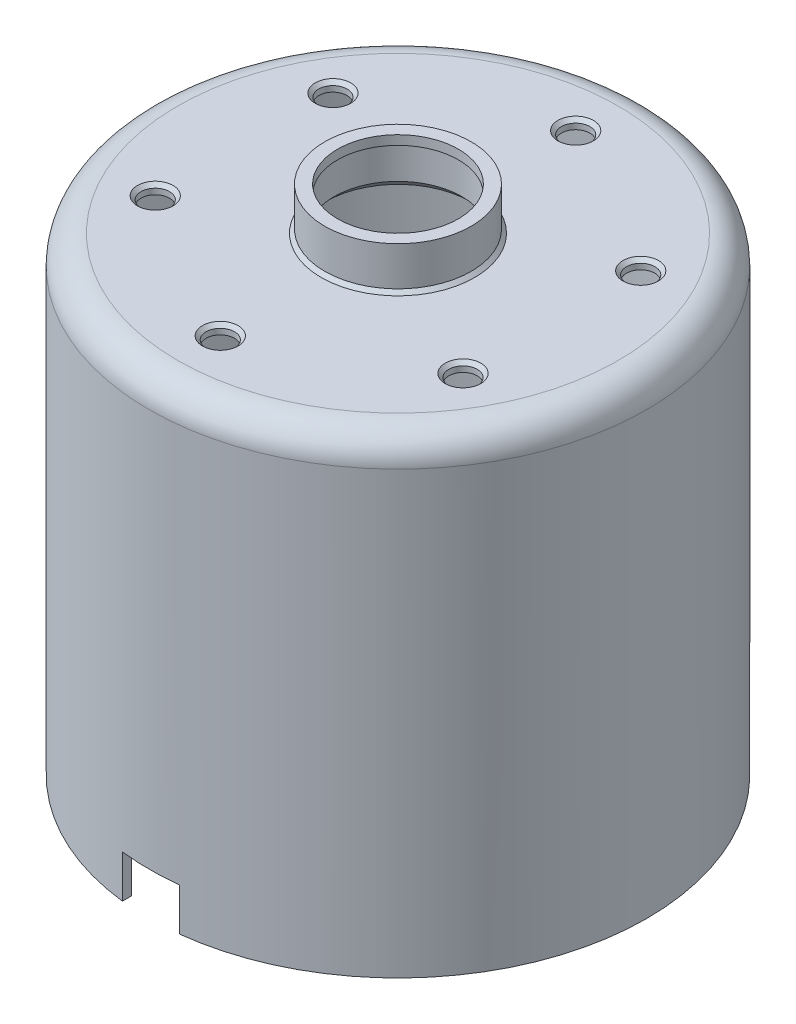
from build123d import *

# Parameters (mm, degrees)
SKETCH1_R                    = 17.5
BOSS_EXTRUDE1_DEPTH          = 33
FILLET1_R                    = 2
SKETCH3_R                    = 5.15
BOSS_EXTRUDE2_DEPTH          = 3
CHAMFER1_SIZE                = 0.25
SHELL1_T                     = -0.65
CUT_EXTRUDE1_REACH           = 45.686
SKETCH4_R                    = 4.25
CUT_EXTRUDE2_REACH           = 43.249
SKETCH5_R                    = 1
CHAMFER2_SIZE                = 0.25
CIRPATTERN1_COUNT            = 6
CHAMFER2_OF_CIRPATTERN1_SIZE = 0.25
CUT_EXTRUDE3_REACH           = 55.172
CUT_EXTRUDE3_END_RADIUS      = 16.85
SKETCH6_W                    = 4
SKETCH6_H                    = 6


with BuildPart() as part:
    # Sketch1 → Boss-Extrude1 (new body)
    with BuildSketch(Plane(origin=(0, 0, 0), x_dir=(1, 0, 0), z_dir=(0, 1, 0))):
        with Locations(Location((0, 0, 0), (0, 0, 270))):
            Circle(SKETCH1_R)
    extrude(amount=BOSS_EXTRUDE1_DEPTH)

    # Fillet1
    fillet1_edges = [part.edges().sort_by_distance(p)[0] for p in [
        (0, 33, -17.5),
    ]]
    fillet(fillet1_edges, radius=FILLET1_R)

    # Sketch3 → Boss-Extrude2 (add)
    with BuildSketch(Plane(origin=(0, 33, 0), x_dir=(1, 0, 0), z_dir=(0, 1, 0))):
        with Locations(Location((0, 0, 0), (0, 0, 270))):
            Circle(SKETCH3_R)
    extrude(amount=BOSS_EXTRUDE2_DEPTH)

    # Chamfer1
    chamfer1_edges = [part.edges().sort_by_distance(p)[0] for p in [
        (0, 33, -5.15),
    ]]
    chamfer(chamfer1_edges, length=CHAMFER1_SIZE)

    # Shell1
    shell1_openings = [part.faces().sort_by_distance(p)[0] for p in [
        (0, 0, 0),
    ]]
    offset(amount=SHELL1_T, openings=shell1_openings, kind=Kind.INTERSECTION)

    # Sketch4 → Cut-Extrude1 (cut, up to next)
    with BuildSketch(Plane(origin=(0, 36, 0), x_dir=(1, 0, 0), z_dir=(0, 1, 0)), mode=Mode.PRIVATE) as cut_extrude1_sk1:
        with Locations(Location((0, 0, 0), (0, 0, 270))):
            Circle(SKETCH4_R)
    cut_extrude1_tool1 = extrude(cut_extrude1_sk1.sketch, amount=-CUT_EXTRUDE1_REACH, mode=Mode.PRIVATE) & part.part
    add(cut_extrude1_tool1.solids().sort_by_distance((0, 36, 0))[0], mode=Mode.SUBTRACT)

    # Sketch5 → Cut-Extrude2 (cut, up to next)
    with BuildSketch(Plane(origin=(0, 33, 0), x_dir=(1, 0, 0), z_dir=(0, 1, 0)), mode=Mode.PRIVATE) as cut_extrude2_sk1:
        with Locations(Location((0, 12.5, 0), (0, 0, 270))):
            Circle(SKETCH5_R)
    cut_extrude2_tool1 = extrude(cut_extrude2_sk1.sketch, amount=-CUT_EXTRUDE2_REACH, mode=Mode.PRIVATE) & part.part
    cut_extrude2 = cut_extrude2_tool1.solids().sort_by_distance((0, 33, -12.5))[0]
    add(cut_extrude2, mode=Mode.SUBTRACT)

    # Chamfer2
    chamfer2_edges = [part.edges().sort_by_distance(p)[0] for p in [
        (0, 33, -13.5),
    ]]
    chamfer(chamfer2_edges, length=CHAMFER2_SIZE)

    # CirPattern1: Cut-Extrude2 ×6 about axis
    cirpattern1_axis = Axis((0, 0, 0), (0, 1, 0))
    for i in range(1, CIRPATTERN1_COUNT):
        add(cut_extrude2.rotate(cirpattern1_axis, i * 360 / CIRPATTERN1_COUNT), mode=Mode.SUBTRACT)

    # Chamfer2 of CirPattern1
    chamfer2_of_cirpattern1_edges = [part.edges().sort_by_distance(p)[0] for p in [
        (-11.691342951, 33, -6.75),
        (-11.691342951, 33, 6.75),
        (0, 33, 13.5),
        (11.691342951, 33, 6.75),
        (11.691342951, 33, -6.75),
    ]]
    chamfer(chamfer2_of_cirpattern1_edges, length=CHAMFER2_OF_CIRPATTERN1_SIZE)

    # Cut-Extrude3: up to this cylinder (the profile starts outside it)
    cut_extrude3_end = Plane(origin=(0, 0, 0), z_dir=(0, -1, 0)) * Cylinder(CUT_EXTRUDE3_END_RADIUS, 145.044, mode=Mode.PRIVATE)
    # Sketch6 → Cut-Extrude3 (cut, up to the surface)
    with BuildSketch(Plane.XY.offset(17.5), mode=Mode.PRIVATE) as cut_extrude3_sk1:
        Rectangle(SKETCH6_W, SKETCH6_H)
    cut_extrude3_tool1 = extrude(cut_extrude3_sk1.sketch, amount=-CUT_EXTRUDE3_REACH, mode=Mode.PRIVATE) - cut_extrude3_end
    add(cut_extrude3_tool1.solids().sort_by_distance((0, 0, 17.5))[0], mode=Mode.SUBTRACT)


solid = part.part
